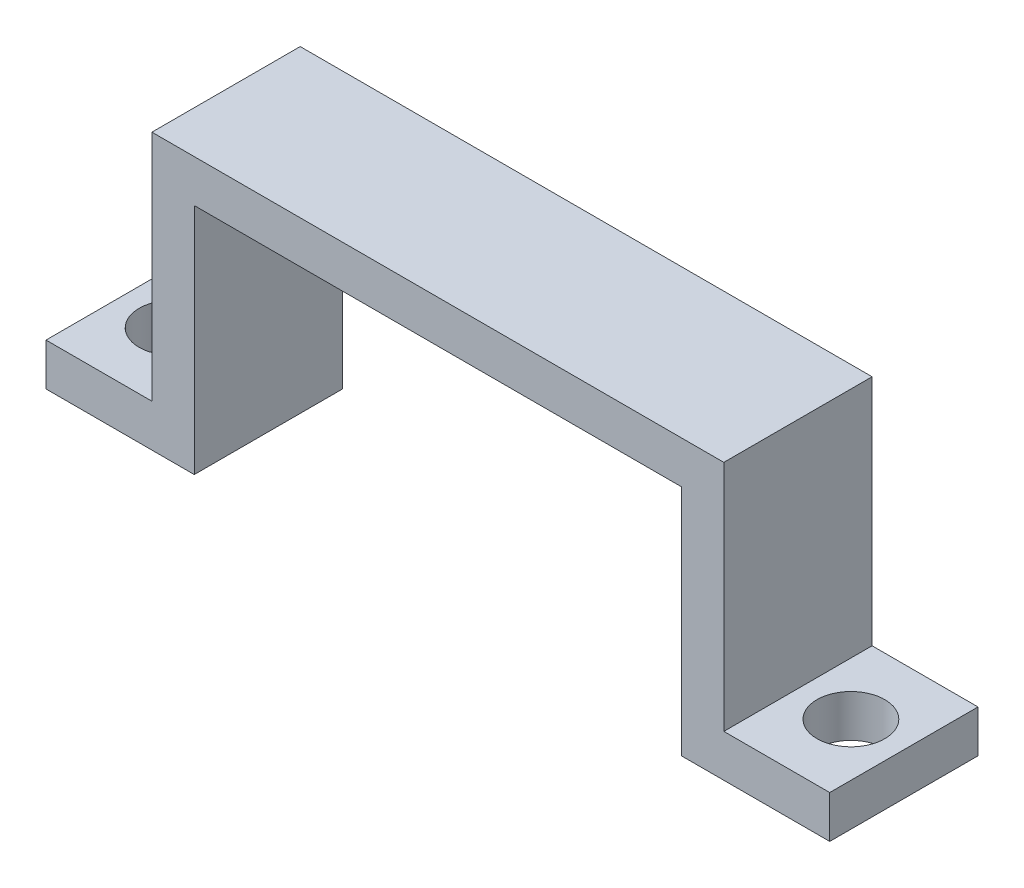
from build123d import *

# Parameters (mm, degrees)
EXTRUDE_1_DEPTH     = 7
SKETCH_2_R          = 1.6
CUT_EXTRUDE_1_DEPTH = 2


with BuildPart() as part:
    # 草圖1 → 填料-伸長1 (new body)
    with BuildSketch(Plane.XY):
        Polygon((-13.5, 0), (13.5, 0), (13.5, -11), (18.5, -11), (18.5, -13), (11.5, -13), (11.5, -2), (-11.5, -2), (-11.5, -13), (-18.5, -13), (-18.5, -11), (-13.5, -11), align=None)
    extrude(amount=EXTRUDE_1_DEPTH)

    # 草圖2 → 除料-伸長1 (cut)
    with BuildSketch(Plane(origin=(0, -11, 0), x_dir=(1, 0, 0), z_dir=(0, 1, 0))):
        with Locations(Location((16, -3.5, 0), (0, 0, 270))):
            Circle(SKETCH_2_R)
        with Locations(Location((-16, -3.5, 0), (0, 0, 270))):
            Circle(SKETCH_2_R)
    extrude(amount=-CUT_EXTRUDE_1_DEPTH, mode=Mode.SUBTRACT)


solid = part.part
